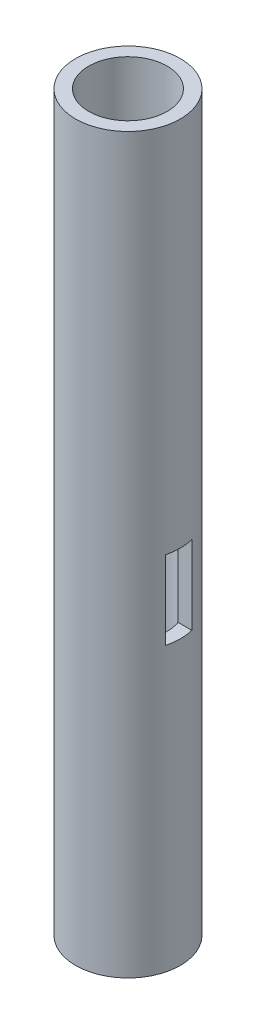
from build123d import *

# Parameters (mm, degrees)
SKETCH1_R               = 12.7
SKETCH1_R_2             = 9.525
BOSS_EXTRUDE1_DEPTH     = 177.8
CUT_EXTRUDE1_DEPTH      = 179.704840449
CUT_EXTRUDE1_DEPTH_BACK = 179.704840449
SKETCH2_W               = 6.35
SKETCH2_H               = 19.05


with BuildPart() as part:
    # Sketch1 → Boss-Extrude1 (new body)
    with BuildSketch(Plane(origin=(0, 0, 0), x_dir=(1, 0, 0), z_dir=(0, 1, 0))):
        with Locations(Location((0, 0, 0), (0, 0, 270))):
            Circle(SKETCH1_R)
        with Locations(Location((0, 0, 0), (0, 0, 270))):
            Circle(SKETCH1_R_2, mode=Mode.SUBTRACT)
    extrude(amount=BOSS_EXTRUDE1_DEPTH)

    # Sketch2 → Cut-Extrude1 (cut, two sides: drawn at the far end of the back side and taken through both)
    with BuildSketch(Plane(origin=(0, 0, 0), x_dir=(0, 0, -1), z_dir=(1, 0, 0)).offset(-CUT_EXTRUDE1_DEPTH_BACK)):
        with Locations((0, 78.14564)):
            Rectangle(SKETCH2_W, SKETCH2_H)
    extrude(amount=CUT_EXTRUDE1_DEPTH + CUT_EXTRUDE1_DEPTH_BACK, mode=Mode.SUBTRACT)


solid = part.part
